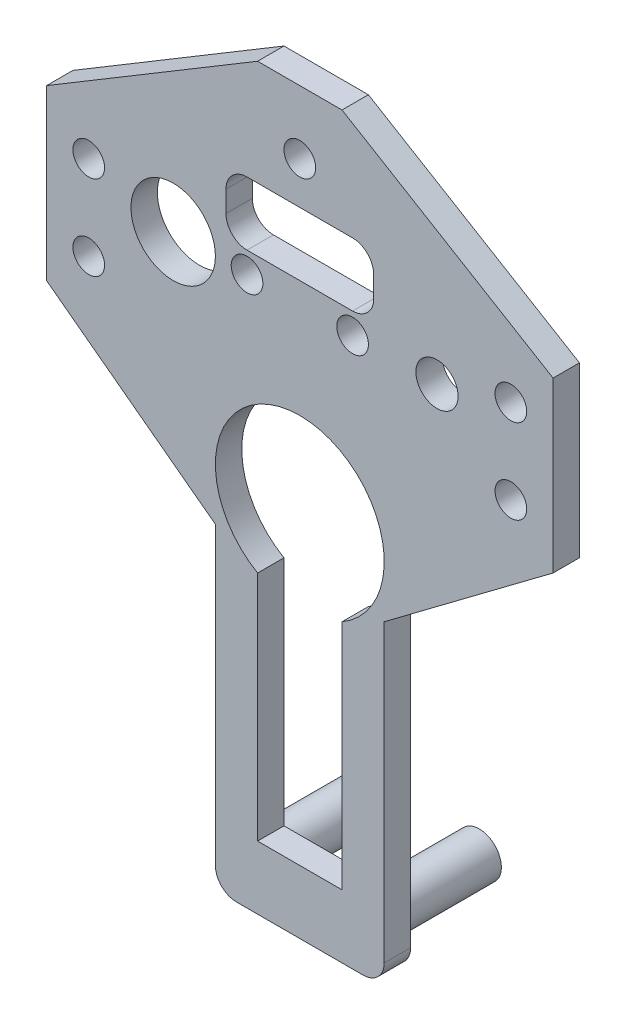
from build123d import *

# Parameters (mm, degrees)
SKETCH1_R           = 4
SKETCH1_R_2         = 1.5
SKETCH1_R_3         = 2
BOSS_EXTRUDE1_DEPTH = 2.5
SKETCH2_R           = 2.1
BOSS_EXTRUDE2_DEPTH = 9.5
SKETCH4_R           = 1.5
CUT_EXTRUDE1_DEPTH  = 5


with BuildPart() as part:
    # Sketch1 → Boss-Extrude1 (new body)
    with BuildSketch(Plane.XY):
        with BuildLine():
            Line((-24, 7.07179677), (-24, 23.07179677))
            Line((-24, 23.07179677), (-4, 35.07179677))
            Line((-4, 35.07179677), (4, 35.07179677))
            Line((4, 35.07179677), (24, 23.07179677))
            Line((24, 23.07179677), (24, 7.07179677))
            Line((24, 7.07179677), (8, -4.92820323))
            Line((8, -4.92820323), (8, -32.92820323))
            ThreePointArc((8, -32.92820323), (7.414213562, -34.342416793), (6, -34.92820323))
            Line((6, -34.92820323), (-6, -34.92820323))
            ThreePointArc((-6, -34.92820323), (-7.414213562, -34.342416793), (-8, -32.92820323))
            Line((-8, -32.92820323), (-8, -4.92820323))
            Line((-8, -4.92820323), (-24, 7.07179677))
        make_face()
        with Locations((-12, 17.07179677)):
            Circle(SKETCH1_R, mode=Mode.SUBTRACT)
        with Locations((-5, 17.07179677)):
            Circle(SKETCH1_R_2, mode=Mode.SUBTRACT)
        with Locations((5, 17.07179677)):
            Circle(SKETCH1_R_2, mode=Mode.SUBTRACT)
        with Locations((0, 29.07179677)):
            Circle(SKETCH1_R_2, mode=Mode.SUBTRACT)
        with Locations((20, 19.07179677)):
            Circle(SKETCH1_R_2, mode=Mode.SUBTRACT)
        with Locations((20, 11.07179677)):
            Circle(SKETCH1_R_2, mode=Mode.SUBTRACT)
        with Locations((-20, 19.07179677)):
            Circle(SKETCH1_R_2, mode=Mode.SUBTRACT)
        with Locations((-20, 11.07179677)):
            Circle(SKETCH1_R_2, mode=Mode.SUBTRACT)
        with Locations((13, 17.07179677)):
            Circle(SKETCH1_R_3, mode=Mode.SUBTRACT)
        with BuildLine():
            Line((4, -28.92820323), (-4, -28.92820323))
            Line((-4, -28.92820323), (-4, -6.92820323))
            ThreePointArc((-4, -6.92820323), (0, 8), (4, -6.92820323))
            Line((4, -6.92820323), (4, -28.92820323))
        make_face(mode=Mode.SUBTRACT)
        with BuildLine():
            Line((-5, 25.07179677), (5, 25.07179677))
            ThreePointArc((5, 25.07179677), (6.414213562, 24.486010332), (7, 23.07179677))
            Line((7, 23.07179677), (7, 21.07179677))
            ThreePointArc((7, 21.07179677), (6.414213562, 19.657583207), (5, 19.07179677))
            Line((5, 19.07179677), (-5, 19.07179677))
            ThreePointArc((-5, 19.07179677), (-6.414213562, 19.657583207), (-7, 21.07179677))
            Line((-7, 21.07179677), (-7, 23.07179677))
            ThreePointArc((-7, 23.07179677), (-6.414213562, 24.486010332), (-5, 25.07179677))
        make_face(mode=Mode.SUBTRACT)
    extrude(amount=BOSS_EXTRUDE1_DEPTH)

    # Sketch2 → Boss-Extrude2 (add)
    with BuildSketch(Plane(origin=(0, 0, 0), x_dir=(-1, 0, 0), z_dir=(0, 0, -1))):
        with Locations(Location((-5, -31.52820323, 0), (0, 0, 180))):
            Circle(SKETCH2_R)
        with Locations(Location((5, -31.52820323, 0), (0, 0, 180))):
            Circle(SKETCH2_R)
    extrude(amount=BOSS_EXTRUDE2_DEPTH)

    # Sketch4 → Cut-Extrude1 (cut)
    with BuildSketch(Plane(origin=(0, 0, -9.5), x_dir=(-1, 0, 0), z_dir=(0, 0, -1))):
        with Locations((-5, -31.52820323)):
            Circle(SKETCH4_R)
        with Locations((5, -31.52820323)):
            Circle(SKETCH4_R)
    extrude(amount=-CUT_EXTRUDE1_DEPTH, mode=Mode.SUBTRACT)


solid = part.part
